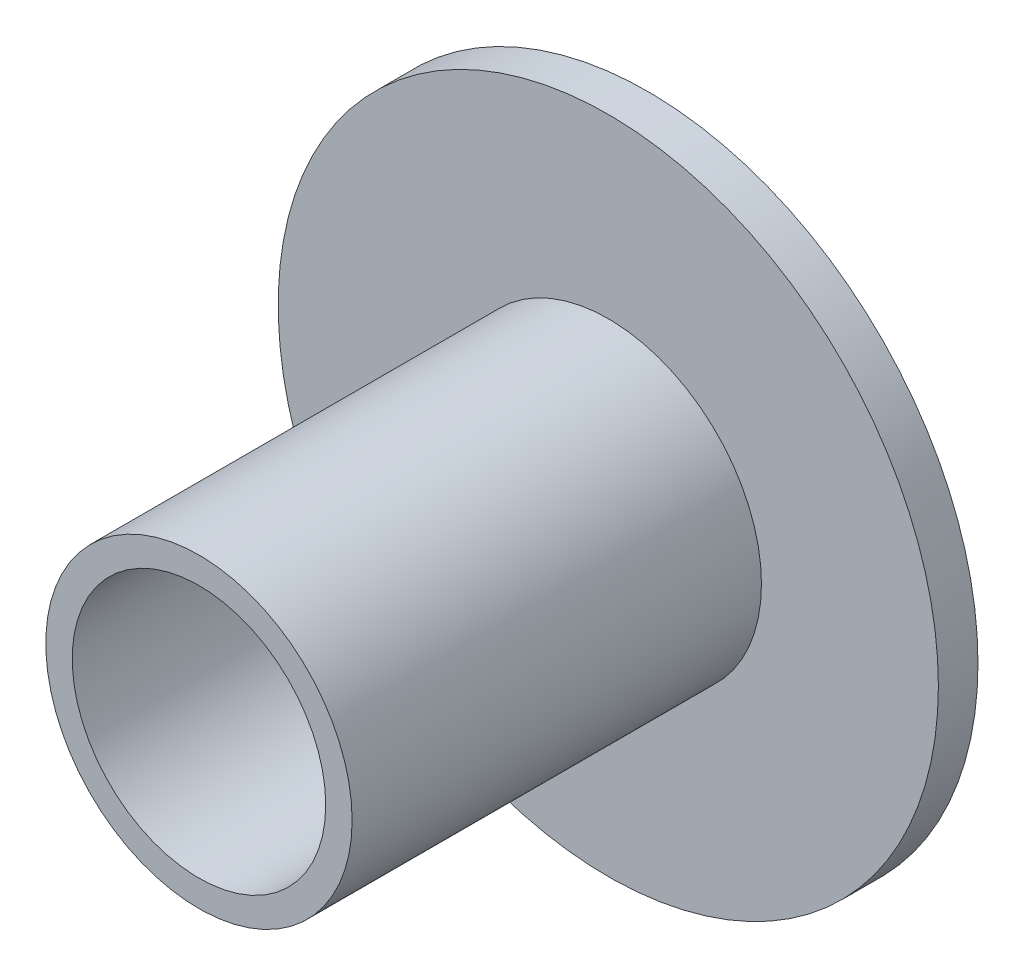
from build123d import *

# Parameters (mm, degrees)
SKETCH1_R           = 3.175
SKETCH1_R_2         = 1.2192
BOSS_EXTRUDE1_DEPTH = 0.381
BOSS_EXTRUDE2_START = 3.937
SKETCH1_3_R         = 1.4732
SKETCH1_3_R_2       = 1.2192
BOSS_EXTRUDE2_DEPTH = 3.937


with BuildPart() as part:
    # Sketch1 → Boss-Extrude1 (new body)
    with BuildSketch(Plane.XY):
        Circle(SKETCH1_R)
        Circle(SKETCH1_R_2, mode=Mode.SUBTRACT)
    extrude(amount=-BOSS_EXTRUDE1_DEPTH)

    # Sketch1<3> → Boss-Extrude2 (add)
    with BuildSketch(Plane.XY.offset(BOSS_EXTRUDE2_START)):
        Circle(SKETCH1_3_R)
        Circle(SKETCH1_3_R_2, mode=Mode.SUBTRACT)
    extrude(amount=-BOSS_EXTRUDE2_DEPTH)


solid = part.part
